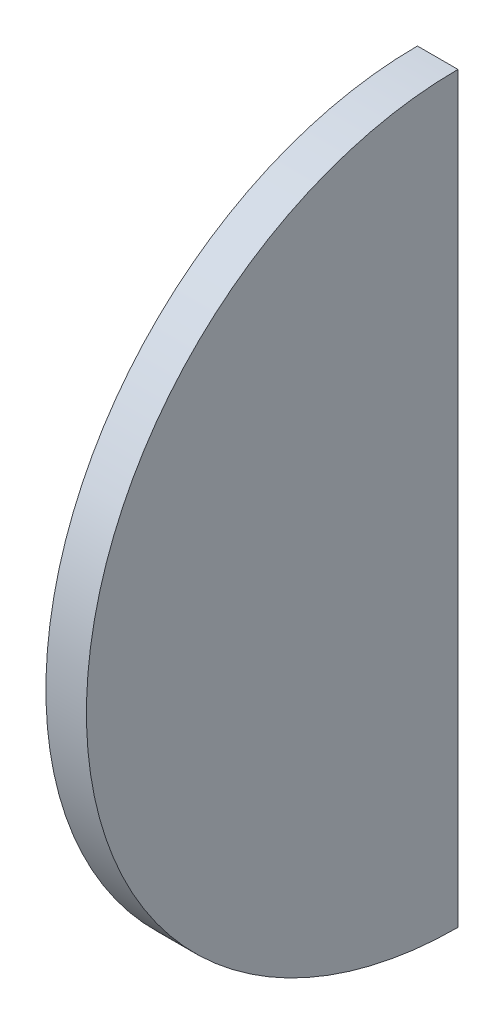
from build123d import *

# Parameters (mm, degrees)
BOSS_EXTRUDE1_DEPTH = 76.2


with BuildPart() as part:
    # Sketch1 → Boss-Extrude1 (new body)
    with BuildSketch(Plane(origin=(0, 0, 0), x_dir=(0, 0, -1), z_dir=(1, 0, 0))):
        with BuildLine():
            Line((0, 698.5), (0, -698.5))
            ThreePointArc((0, -698.5), (-698.5, 0), (0, 698.5))
        make_face()
    extrude(amount=BOSS_EXTRUDE1_DEPTH)


solid = part.part
